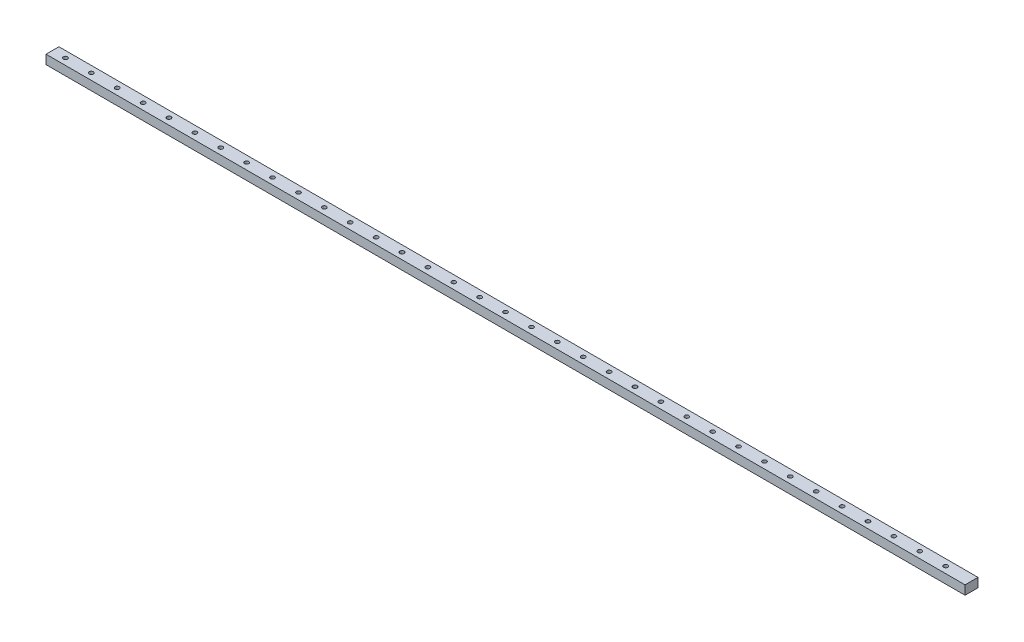
from build123d import *

# Parameters (mm, degrees)
SKETCH_1_W      = 710
SKETCH_1_H      = 10
SKETCH_1_R      = 1.6
EXTRUDE_1_DEPTH = 7


with BuildPart() as part:
    # 草图1 → 凸台-拉伸1 (new body)
    with BuildSketch(Plane(origin=(0, 0, 0), x_dir=(1, 0, 0), z_dir=(0, 1, 0))):
        Rectangle(SKETCH_1_W, SKETCH_1_H)
        with Locations(Location((-345, 0, 0), (0, 0, 270))):
            Circle(SKETCH_1_R, mode=Mode.SUBTRACT)
        with Locations(Location((-325, 0, 0), (0, 0, 270))):
            Circle(SKETCH_1_R, mode=Mode.SUBTRACT)
        with Locations(Location((-305, 0, 0), (0, 0, 270))):
            Circle(SKETCH_1_R, mode=Mode.SUBTRACT)
        with Locations(Location((-285, 0, 0), (0, 0, 270))):
            Circle(SKETCH_1_R, mode=Mode.SUBTRACT)
        with Locations(Location((-265, 0, 0), (0, 0, 270))):
            Circle(SKETCH_1_R, mode=Mode.SUBTRACT)
        with Locations(Location((-245, 0, 0), (0, 0, 270))):
            Circle(SKETCH_1_R, mode=Mode.SUBTRACT)
        with Locations(Location((-225, 0, 0), (0, 0, 270))):
            Circle(SKETCH_1_R, mode=Mode.SUBTRACT)
        with Locations(Location((-205, 0, 0), (0, 0, 270))):
            Circle(SKETCH_1_R, mode=Mode.SUBTRACT)
        with Locations(Location((-185, 0, 0), (0, 0, 270))):
            Circle(SKETCH_1_R, mode=Mode.SUBTRACT)
        with Locations(Location((-165, 0, 0), (0, 0, 270))):
            Circle(SKETCH_1_R, mode=Mode.SUBTRACT)
        with Locations(Location((-145, 0, 0), (0, 0, 270))):
            Circle(SKETCH_1_R, mode=Mode.SUBTRACT)
        with Locations(Location((-125, 0, 0), (0, 0, 270))):
            Circle(SKETCH_1_R, mode=Mode.SUBTRACT)
        with Locations(Location((-105, 0, 0), (0, 0, 270))):
            Circle(SKETCH_1_R, mode=Mode.SUBTRACT)
        with Locations(Location((-85, 0, 0), (0, 0, 270))):
            Circle(SKETCH_1_R, mode=Mode.SUBTRACT)
        with Locations(Location((-65, 0, 0), (0, 0, 270))):
            Circle(SKETCH_1_R, mode=Mode.SUBTRACT)
        with Locations(Location((-45, 0, 0), (0, 0, 270))):
            Circle(SKETCH_1_R, mode=Mode.SUBTRACT)
        with Locations(Location((-25, 0, 0), (0, 0, 270))):
            Circle(SKETCH_1_R, mode=Mode.SUBTRACT)
        with Locations(Location((-5, 0, 0), (0, 0, 270))):
            Circle(SKETCH_1_R, mode=Mode.SUBTRACT)
        with Locations(Location((15, 0, 0), (0, 0, 270))):
            Circle(SKETCH_1_R, mode=Mode.SUBTRACT)
        with Locations(Location((35, 0, 0), (0, 0, 270))):
            Circle(SKETCH_1_R, mode=Mode.SUBTRACT)
        with Locations(Location((55, 0, 0), (0, 0, 270))):
            Circle(SKETCH_1_R, mode=Mode.SUBTRACT)
        with Locations(Location((75, 0, 0), (0, 0, 270))):
            Circle(SKETCH_1_R, mode=Mode.SUBTRACT)
        with Locations(Location((95, 0, 0), (0, 0, 270))):
            Circle(SKETCH_1_R, mode=Mode.SUBTRACT)
        with Locations(Location((115, 0, 0), (0, 0, 270))):
            Circle(SKETCH_1_R, mode=Mode.SUBTRACT)
        with Locations(Location((135, 0, 0), (0, 0, 270))):
            Circle(SKETCH_1_R, mode=Mode.SUBTRACT)
        with Locations(Location((155, 0, 0), (0, 0, 270))):
            Circle(SKETCH_1_R, mode=Mode.SUBTRACT)
        with Locations(Location((175, 0, 0), (0, 0, 270))):
            Circle(SKETCH_1_R, mode=Mode.SUBTRACT)
        with Locations(Location((195, 0, 0), (0, 0, 270))):
            Circle(SKETCH_1_R, mode=Mode.SUBTRACT)
        with Locations(Location((215, 0, 0), (0, 0, 270))):
            Circle(SKETCH_1_R, mode=Mode.SUBTRACT)
        with Locations(Location((235, 0, 0), (0, 0, 270))):
            Circle(SKETCH_1_R, mode=Mode.SUBTRACT)
        with Locations(Location((255, 0, 0), (0, 0, 270))):
            Circle(SKETCH_1_R, mode=Mode.SUBTRACT)
        with Locations(Location((275, 0, 0), (0, 0, 270))):
            Circle(SKETCH_1_R, mode=Mode.SUBTRACT)
        with Locations(Location((295, 0, 0), (0, 0, 270))):
            Circle(SKETCH_1_R, mode=Mode.SUBTRACT)
        with Locations(Location((315, 0, 0), (0, 0, 270))):
            Circle(SKETCH_1_R, mode=Mode.SUBTRACT)
        with Locations(Location((335, 0, 0), (0, 0, 270))):
            Circle(SKETCH_1_R, mode=Mode.SUBTRACT)
    extrude(amount=EXTRUDE_1_DEPTH)


solid = part.part
